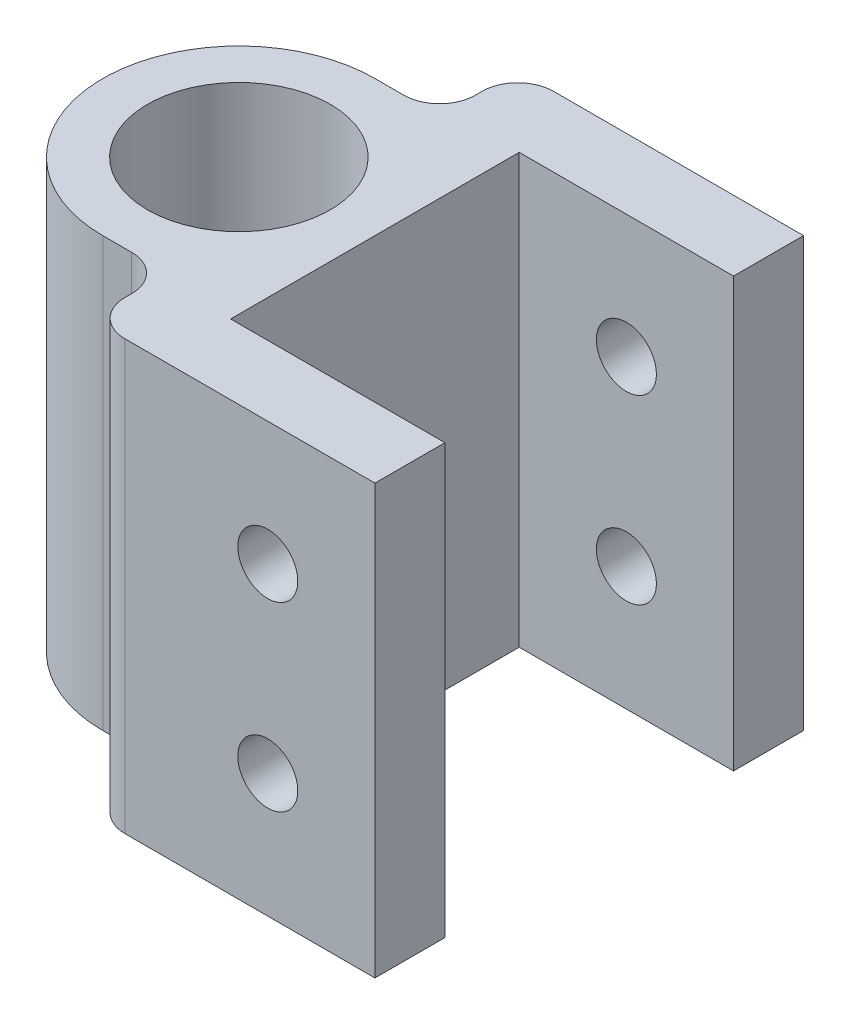
from build123d import *

# Parameters (mm, degrees)
SKETCH1_W                   = 15
SKETCH1_H                   = 4.9
SKETCH1_W_2                 = 5
SKETCH1_H_2                 = 19.05
SKETCH1_W_3                 = 14.05
BOSS_EXTRUDE1_DEPTH         = 30
SKETCH2_R                   = 6.4
CUT_EXTRUDE1_DEPTH          = 43.069832248
CUT_EXTRUDE2_DEPTH          = 30
FILLET1_R                   = 2.5
TAP_DRILL_FOR_M5X0_8_TAP1_D = 4.2


with BuildPart() as part:
    # Sketch1 → Boss-Extrude1 (new body)
    with BuildSketch(Plane(origin=(0, 0, 0), x_dir=(1, 0, 0), z_dir=(0, 1, 0))):
        with Locations((2.312030075, 14.354511278)):
            Rectangle(SKETCH1_W, SKETCH1_H)
        Polygon((-5.187969925, 16.804511278), (-10.187969925, 16.804511278), (-10.187969925, 11.329511278), (-5.187969925, 11.329511278), (-5.187969925, 11.904511278), align=None)
        with Locations((-7.687969925, 1.804511278)):
            Rectangle(SKETCH1_W_2, SKETCH1_H_2)
        with Locations((-17.212969925, 1.804511278)):
            Rectangle(SKETCH1_W_3, SKETCH1_H_2)
        Polygon((-5.187969925, -7.720488722), (-10.187969925, -7.720488722), (-10.187969925, -13.195488722), (-5.187969925, -13.195488722), (-5.187969925, -8.295488722), align=None)
        with Locations((2.312030075, -10.745488722)):
            Rectangle(SKETCH1_W, SKETCH1_H)
    extrude(amount=BOSS_EXTRUDE1_DEPTH)

    # Sketch2 → Cut-Extrude1 (cut, through all)
    with BuildSketch(Plane(origin=(0, 30, 0), x_dir=(1, 0, 0), z_dir=(0, 1, 0))):
        with Locations(Location((-14.712969925, 1.804511278, 0), (0, 0, 270))):
            Circle(SKETCH2_R)
    extrude(amount=-CUT_EXTRUDE1_DEPTH, mode=Mode.SUBTRACT)

    # Sketch4 → Cut-Extrude2 (cut)
    with BuildSketch(Plane(origin=(0, 30, 0), x_dir=(1, 0, 0), z_dir=(0, 1, 0))):
        with BuildLine():
            Line((-14.712969925, 11.329511278), (-24.237969925, 11.329511278))
            Line((-24.237969925, 11.329511278), (-24.237969925, 1.804511236))
            ThreePointArc((-24.237969925, 1.804511236), (-21.448162031, 8.539703354), (-14.712969925, 11.329511278))
        make_face()
        with BuildLine():
            ThreePointArc((-14.712969925, -7.720488722), (-21.448162001, -4.930680828), (-24.237969925, 1.804511236))
            Line((-24.237969925, 1.804511236), (-24.237969925, -7.720488722))
            Line((-24.237969925, -7.720488722), (-14.712969925, -7.720488722))
        make_face()
    extrude(amount=-CUT_EXTRUDE2_DEPTH, mode=Mode.SUBTRACT)

    # Fillet1
    fillet1_edges = [part.edges().sort_by_distance(p)[0] for p in [
        (-10.187969925, 15, 13.195488722),
        (-10.187969925, 15, 7.720488722),
        (-10.187969925, 15, -11.329511278),
        (-10.187969925, 15, -16.804511278),
    ]]
    fillet(fillet1_edges, radius=FILLET1_R)

    # Tap Drill for M5x0.8 Tap1 (through all)
    with Locations(Plane(origin=(0, 0, -16.804511278), x_dir=(-1, 0, 0), z_dir=(0, 0, -1))):
        with Locations((-2.312030075, 21.35), (-2.312030075, 8.65)):
            Hole(TAP_DRILL_FOR_M5X0_8_TAP1_D / 2)


solid = part.part
